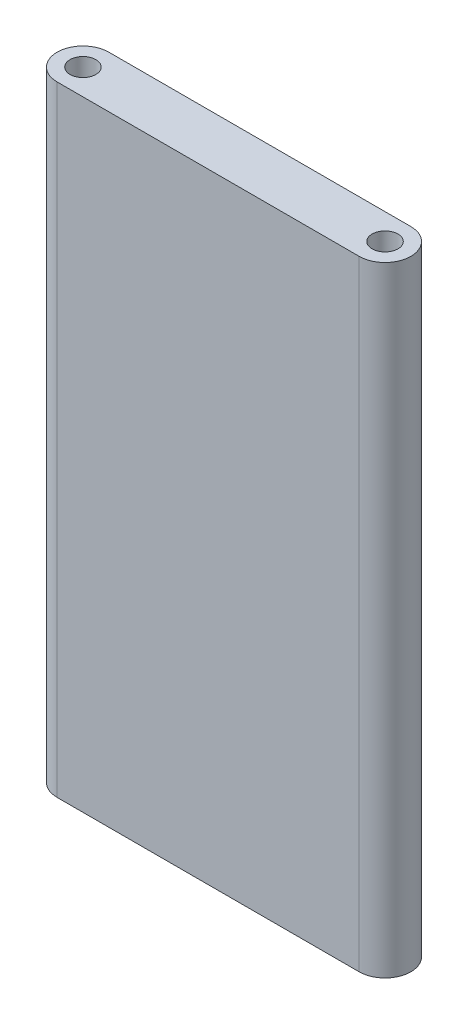
from build123d import *

# Parameters (mm, degrees)
SKETCH1_R           = 3.175
BOSS_EXTRUDE1_DEPTH = 152.4


with BuildPart() as part:
    # Sketch1 → Boss-Extrude1 (new body)
    with BuildSketch(Plane(origin=(0, 0, 0), x_dir=(1, 0, 0), z_dir=(0, 1, 0))):
        with BuildLine():
            Line((-37.1475, 6.35), (37.1475, 6.35))
            ThreePointArc((37.1475, 6.35), (43.4975, 0), (37.1475, -6.35))
            Line((37.1475, -6.35), (-37.1475, -6.35))
            ThreePointArc((-37.1475, -6.35), (-43.4975, 0), (-37.1475, 6.35))
        make_face()
        with Locations(Location((37.1475, 0, 0), (0, 0, 90))):
            Circle(SKETCH1_R, mode=Mode.SUBTRACT)
        with Locations(Location((-37.1475, 0, 0), (0, 0, 90))):
            Circle(SKETCH1_R, mode=Mode.SUBTRACT)
    extrude(amount=BOSS_EXTRUDE1_DEPTH)


solid = part.part
